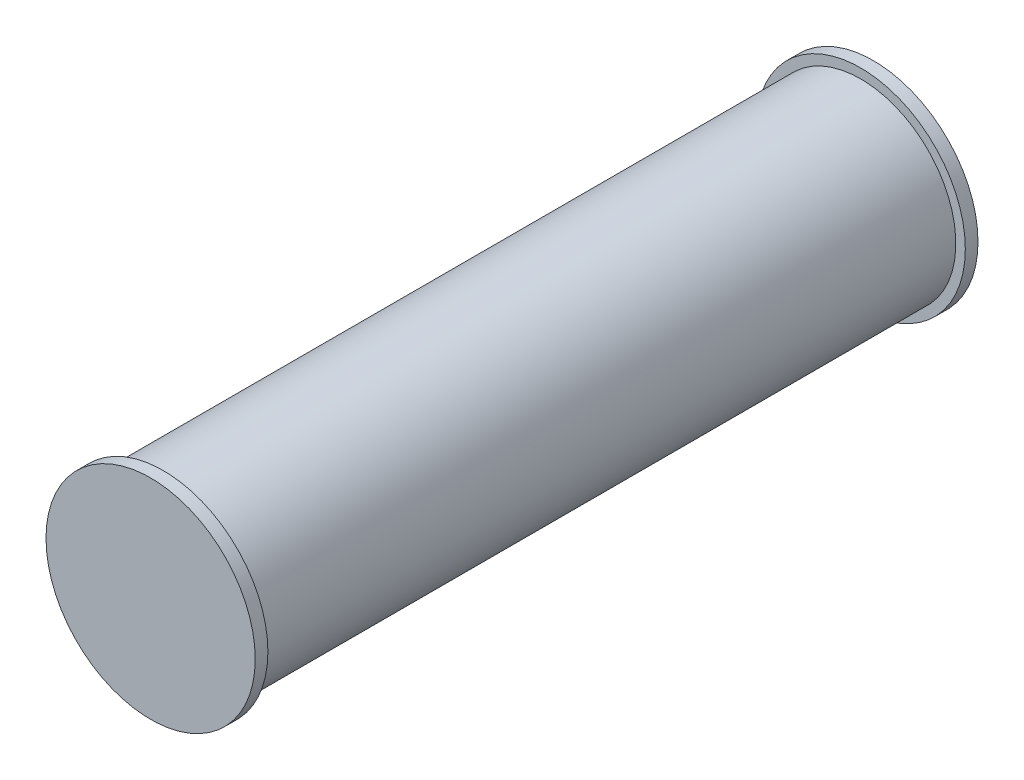
from build123d import *

# Parameters (mm, degrees)
ESQUISSE1_R        = 15
BOSS_EXTRU_1_DEPTH = 110
ESQUISSE2_R        = 16.5
BOSS_EXTRU_2_DEPTH = 2
BOSS_EXTRU_3_START = 2
ESQUISSE3_R        = 16.5
BOSS_EXTRU_3_DEPTH = 2


with BuildPart() as part:
    # Esquisse1 → Boss.-Extru.1 (new body)
    with BuildSketch(Plane.XY):
        Circle(ESQUISSE1_R)
    extrude(amount=BOSS_EXTRU_1_DEPTH)

    # Esquisse2 → Boss.-Extru.2 (add)
    with BuildSketch(Plane(origin=(0, 0, 0), x_dir=(-1, 0, 0), z_dir=(0, 0, -1))):
        Circle(ESQUISSE2_R)
    extrude(amount=BOSS_EXTRU_2_DEPTH)

    # Esquisse3 → Boss.-Extru.3 (add)
    with BuildSketch(Plane.XY.offset(110).offset(BOSS_EXTRU_3_START)):
        with Locations(Location((0, 0, 0), (0, 0, 180))):
            Circle(ESQUISSE3_R)
    extrude(amount=-BOSS_EXTRU_3_DEPTH)


solid = part.part
